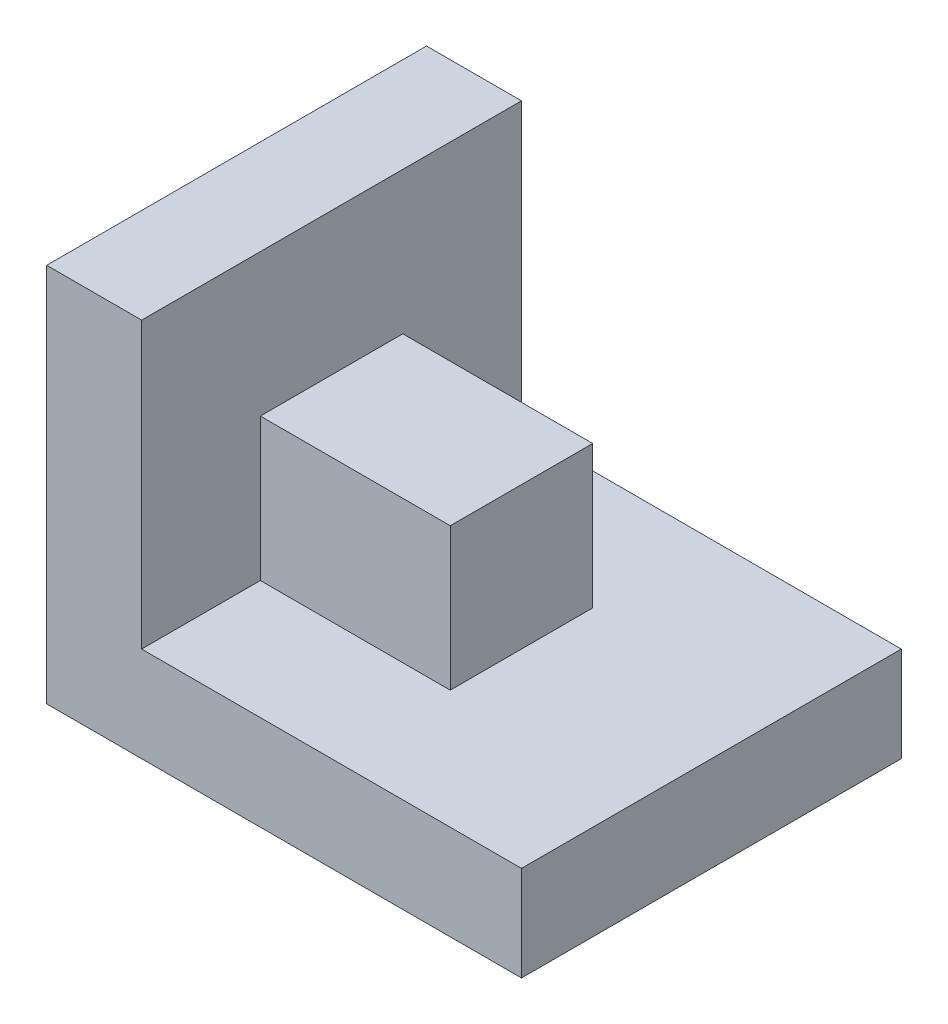
from build123d import *

# Parameters (mm, degrees)
BOSS_EXTRUDE1_DEPTH = 40
SKETCH2_W           = 15
SKETCH2_H           = 15
BOSS_EXTRUDE2_DEPTH = 20


with BuildPart() as part:
    # Sketch1 → Boss-Extrude1 (new body)
    with BuildSketch(Plane.XY):
        Polygon((-23.4375, 10), (-33.4375, 10), (-33.4375, -30), (16.5625, -30), (16.5625, -20), (-23.4375, -20), align=None)
    extrude(amount=BOSS_EXTRUDE1_DEPTH)

    # Sketch2 → Boss-Extrude2 (add)
    with BuildSketch(Plane(origin=(-23.4375, 0, 0), x_dir=(0, 0, -1), z_dir=(1, 0, 0))):
        with Locations((-20, -12.5)):
            Rectangle(SKETCH2_W, SKETCH2_H)
    extrude(amount=BOSS_EXTRUDE2_DEPTH)


solid = part.part
